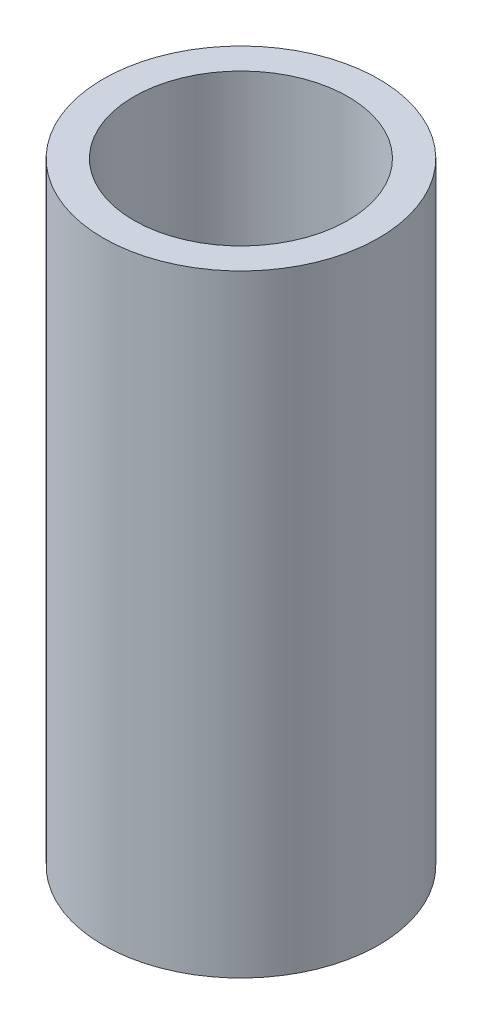
from build123d import *

# Parameters (mm, degrees)
ESBO_O1_R                = 4.5
ESBO_O1_R_2              = 3.5
RESSALTO_EXTRUS_O1_DEPTH = 20


with BuildPart() as part:
    # Esboço1 → Ressalto-extrusão1 (new body)
    with BuildSketch(Plane(origin=(0, 0, 0), x_dir=(1, 0, 0), z_dir=(0, 1, 0))):
        with Locations(Location((0, 0, 0), (0, 0, 270))):
            Circle(ESBO_O1_R)
        with Locations(Location((0, 0, 0), (0, 0, 270))):
            Circle(ESBO_O1_R_2, mode=Mode.SUBTRACT)
    extrude(amount=RESSALTO_EXTRUS_O1_DEPTH)


solid = part.part
